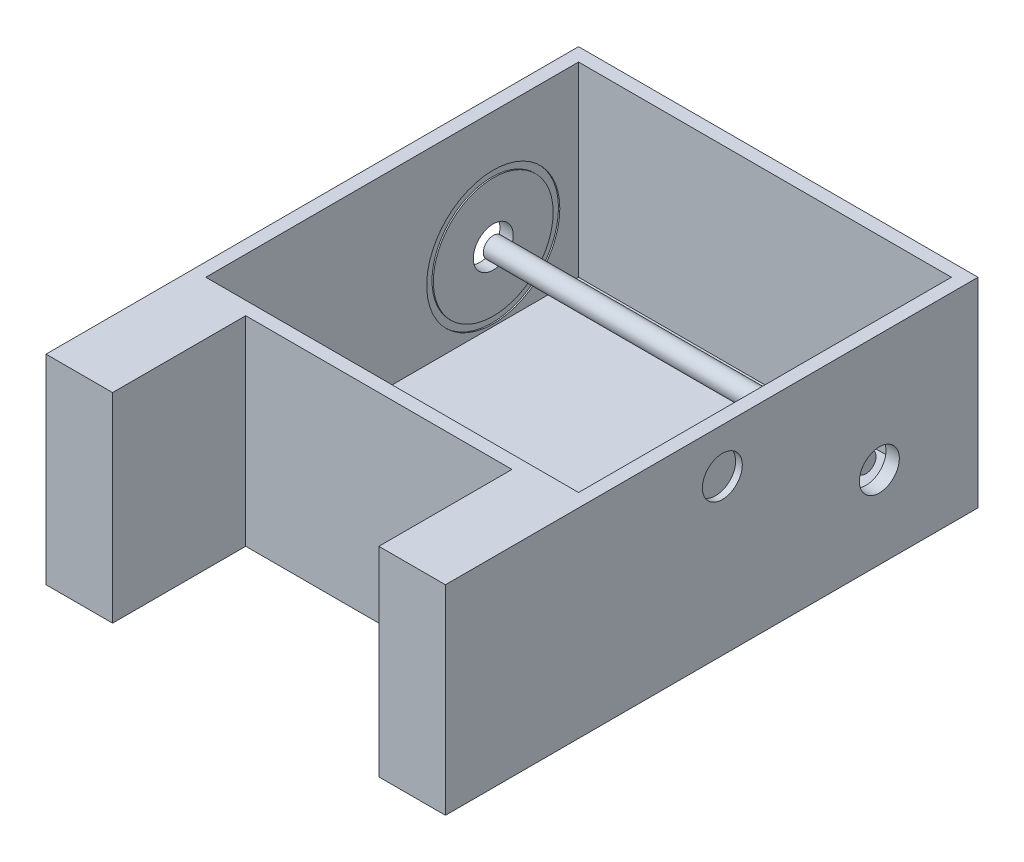
from build123d import *

# Parameters (mm, degrees)
SKETCH1_W               = 300
SKETCH1_H               = 150
BOSS_EXTRUDE1_DEPTH     = 300
SHELL1_T                = -10
CUT_EXTRUDE2_DEPTH      = 284
CUT_EXTRUDE2_DEPTH_BACK = 1
SKETCH2_R               = 50
SKETCH2_R_2             = 45
CUT_EXTRUDE3_DEPTH      = 361
CUT_EXTRUDE3_DEPTH_BACK = 95
SKETCH8_R               = 15
SKETCH9_R               = 7.5
BOSS_EXTRUDE2_DEPTH     = 280
SKETCH14_W              = 50
SKETCH14_H              = 150
BOSS_EXTRUDE4_DEPTH     = 100
SKETCH15_R              = 15
CUT_EXTRUDE6_DEPTH      = 5


with BuildPart() as part:
    # Sketch1 → Boss-Extrude1 (new body)
    with BuildSketch(Plane.XY):
        Rectangle(SKETCH1_W, SKETCH1_H)
    extrude(amount=BOSS_EXTRUDE1_DEPTH)

    # Shell1
    shell1_openings = [part.faces().sort_by_distance(p)[0] for p in [
        (0, 75, 150),
    ]]
    offset(amount=SHELL1_T, openings=shell1_openings, kind=Kind.INTERSECTION)

    # Sketch2 → Cut-Extrude2 (cut, two sides: drawn at the far end of the back side and taken through both)
    with BuildSketch(Plane(origin=(-140, 0, 0), x_dir=(0, 0, -1), z_dir=(1, 0, 0)).offset(-CUT_EXTRUDE2_DEPTH_BACK)):
        with Locations((-74.085565492, -13.257784017)):
            Circle(SKETCH2_R)
        with Locations((-74.085565492, -13.257784017)):
            Circle(SKETCH2_R_2, mode=Mode.SUBTRACT)
    extrude(amount=CUT_EXTRUDE2_DEPTH + CUT_EXTRUDE2_DEPTH_BACK, mode=Mode.SUBTRACT)

    # Sketch8 → Cut-Extrude3 (cut, two sides: drawn at the far end of the back side and taken through both)
    with BuildSketch(Plane(origin=(-140, 0, 0), x_dir=(0, 0, -1), z_dir=(1, 0, 0)).offset(-CUT_EXTRUDE3_DEPTH_BACK)):
        with Locations(Location((-74.085565492, -13.257784017, 0), (0, 0, 180))):
            Circle(SKETCH8_R)
    extrude(amount=CUT_EXTRUDE3_DEPTH + CUT_EXTRUDE3_DEPTH_BACK, mode=Mode.SUBTRACT)

    # Sketch14 → Boss-Extrude4 (add)
    with BuildSketch(Plane.XY.offset(300)):
        with Locations((-125, 0)):
            Rectangle(SKETCH14_W, SKETCH14_H)
        with Locations((125, 0)):
            Rectangle(SKETCH14_W, SKETCH14_H)
    extrude(amount=BOSS_EXTRUDE4_DEPTH)

    # Sketch15 → Cut-Extrude6 (cut)
    with BuildSketch(Plane(origin=(150, 0, 0), x_dir=(0, 0, -1), z_dir=(1, 0, 0))):
        with Locations((-192.016194133, 41.454862356)):
            Circle(SKETCH15_R)
    extrude(amount=-CUT_EXTRUDE6_DEPTH, mode=Mode.SUBTRACT)


with BuildPart() as body_2:
    # Sketch9 → Boss-Extrude2 (new body)
    with BuildSketch(Plane(origin=(-140, 0, 0), x_dir=(0, 0, -1), z_dir=(1, 0, 0))):
        with Locations((-74.085565492, -13.257784017)):
            Circle(SKETCH9_R)
    extrude(amount=BOSS_EXTRUDE2_DEPTH)


solid = Compound([part.part, body_2.part])
